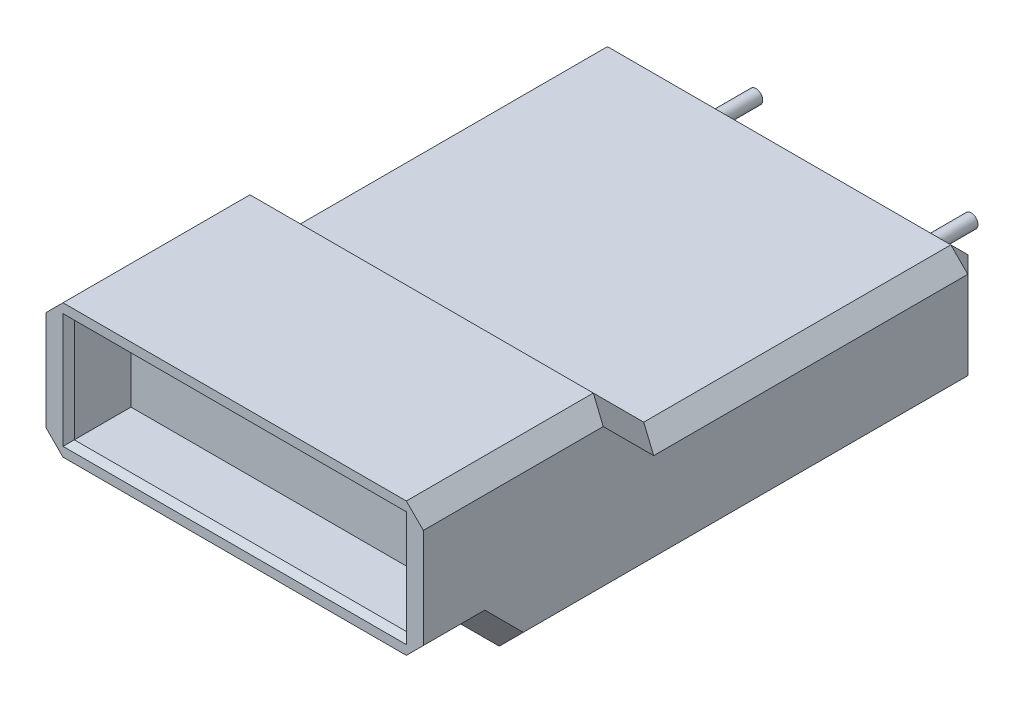
from build123d import *

# Parameters (mm, degrees)
BOSS_EXTRUDE1_DEPTH      = 16.65
BOSS_EXTRUDE1_DEPTH_BACK = 16.65
CHAMFER1_SIZE            = 1.5
SKETCH2_R                = 1.75
BOSS_EXTRUDE2_DEPTH      = 1
SKETCH3_R                = 0.6
BOSS_EXTRUDE3_DEPTH      = 5
SKETCH4_W                = 29.3
SKETCH4_H                = 9.15
CUT_EXTRUDE1_DEPTH       = 5.5
CHAMFER2_SIZE            = 0.5


with BuildPart() as part:
    # Sketch1 → Boss-Extrude1 (new, two sides: drawn at the far end of the back side and taken through both)
    with BuildSketch(Plane(origin=(0, 0, 0), x_dir=(0, 0, -1), z_dir=(1, 0, 0)).offset(-BOSS_EXTRUDE1_DEPTH_BACK)):
        Polygon((-24.775, 15.2), (-8.275, 15.2), (-3.825, 10.75), (24.775, 10.75), (24.775, 0), (-16.575, 0), (-19.975, 3.4), (-24.775, 3.4), align=None)
    extrude(amount=BOSS_EXTRUDE1_DEPTH + BOSS_EXTRUDE1_DEPTH_BACK)

    # Chamfer1
    chamfer1_edges = [part.edges().sort_by_distance(p)[0] for p in [
        (-16.65, 5.375, -24.775),
        (-16.65, 3.4, 22.375),
        (-16.65, 1.7, 18.275),
        (-16.65, 0, -4.1),
        (0, 0, -24.775),
        (16.65, 3.4, 22.375),
        (16.65, 1.7, 18.275),
        (16.65, 0, -4.1),
        (16.65, 5.375, -24.775),
        (-16.65, 15.2, 16.525),
        (-16.65, 12.975, 6.05),
        (-16.65, 10.75, -10.475),
        (0, 10.75, -24.775),
        (16.65, 10.75, -10.475),
        (16.65, 12.975, 6.05),
        (16.65, 15.2, 16.525),
    ]]
    chamfer(chamfer1_edges, length=CHAMFER1_SIZE)

    # Sketch2 → Boss-Extrude2 (add)
    with BuildSketch(Plane(origin=(0, 0, -24.775), x_dir=(-1, 0, 0), z_dir=(0, 0, -1))):
        with Locations((-9.45, 6)):
            Circle(SKETCH2_R)
        with Locations((9.55, 6)):
            Circle(SKETCH2_R)
    extrude(amount=BOSS_EXTRUDE2_DEPTH)

    # Sketch3 → Boss-Extrude3 (add)
    with BuildSketch(Plane(origin=(0, 0, -25.775), x_dir=(-1, 0, 0), z_dir=(0, 0, -1))):
        with Locations((-9.45, 6)):
            Circle(SKETCH3_R)
        with Locations((9.55, 6)):
            Circle(SKETCH3_R)
    extrude(amount=BOSS_EXTRUDE3_DEPTH)

    # Sketch4 → Cut-Extrude1 (cut)
    with BuildSketch(Plane.XY.offset(24.775)):
        with Locations((0, 9.3)):
            Rectangle(SKETCH4_W, SKETCH4_H)
    extrude(amount=-CUT_EXTRUDE1_DEPTH, mode=Mode.SUBTRACT)

    # Chamfer2
    chamfer2_edges = [part.edges().sort_by_distance(p)[0] for p in [
        (14.65, 9.3, 24.775),
        (0, 4.725, 24.775),
        (0, 13.875, 24.775),
        (-14.65, 9.3, 24.775),
    ]]
    chamfer(chamfer2_edges, length=CHAMFER2_SIZE)


solid = part.part
